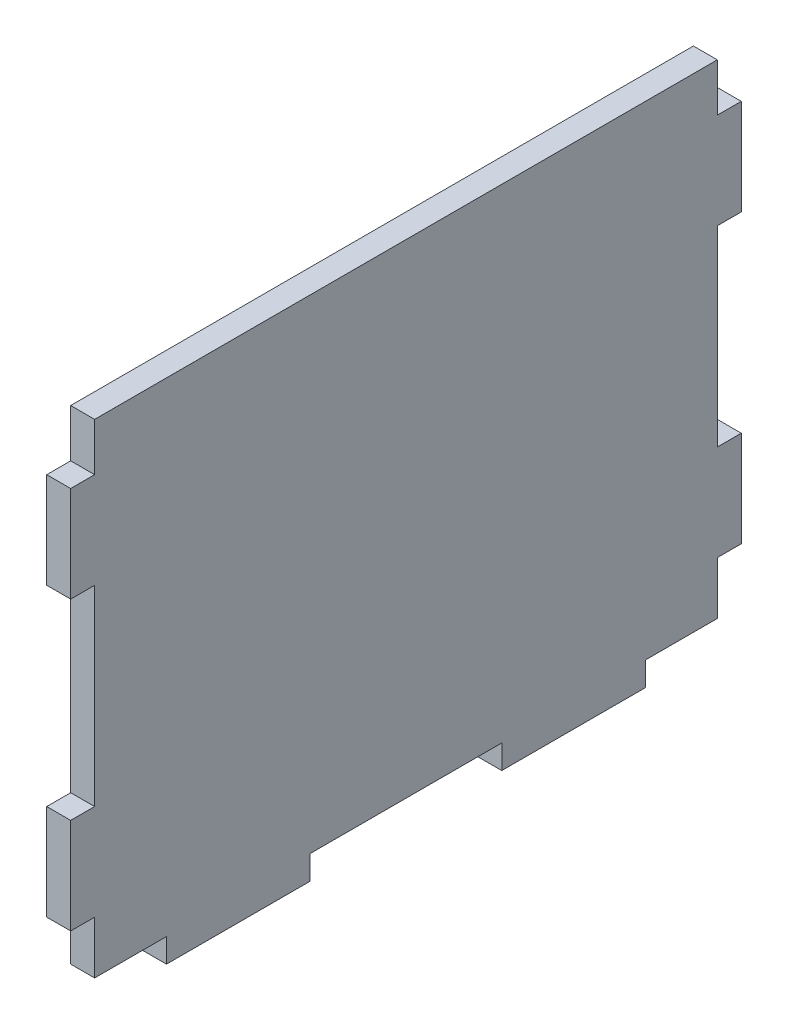
from build123d import *

# Parameters (mm, degrees)
BOSS_EXTRUDE3_DEPTH = 2.5


with BuildPart() as part:
    # Sketch1<5> → Boss-Extrude3 (new body)
    with BuildSketch(Plane(origin=(0, 0, 0), x_dir=(0, 0, -1), z_dir=(1, 0, 0))):
        Polygon((-32.5, -25.5), (-25, -25.5), (-25, -28), (-10, -28), (-10, -25.5), (10, -25.5), (10, -28), (25, -28), (25, -25.5), (32.5, -25.5), (32.5, -20), (35, -20), (35, -10), (32.5, -10), (32.5, 10), (35, 10), (35, 20), (32.5, 20), (32.5, 25), (-32.5, 25), (-32.5, 20), (-35, 20), (-35, 10), (-32.5, 10), (-32.5, -10), (-35, -10), (-35, -20), (-32.5, -20), align=None)
    extrude(amount=BOSS_EXTRUDE3_DEPTH)


solid = part.part
